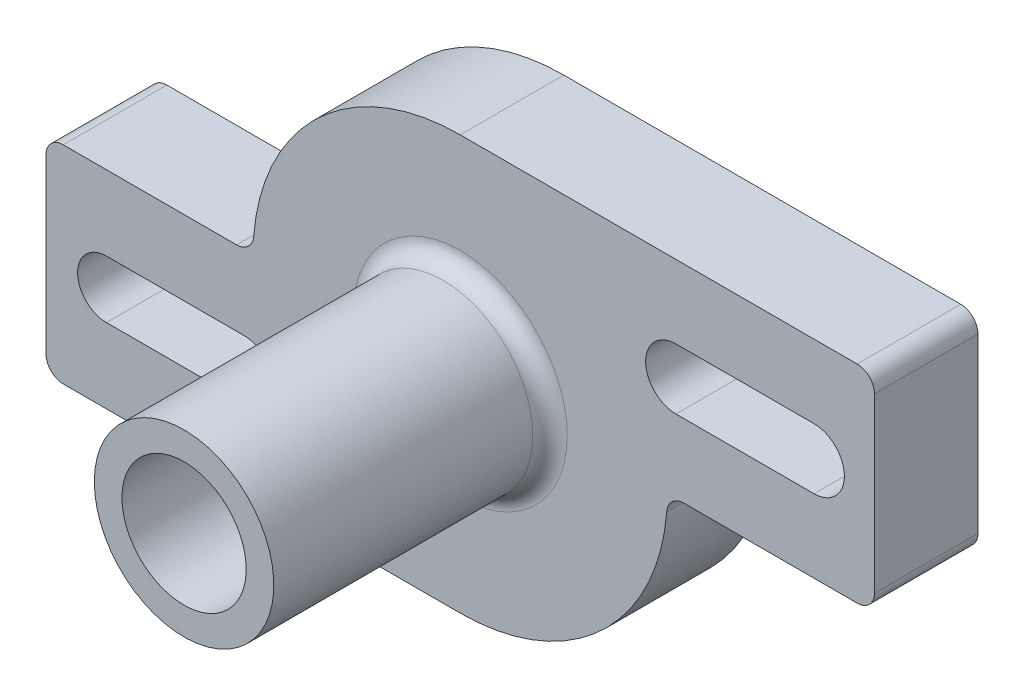
from build123d import *

# Parameters (mm, degrees)
BOSS_EXTRUDE1_DEPTH                                  = 3
SKETCH2_R                                            = 2.6
BOSS_EXTRUDE2_DEPTH                                  = 8
FILLET1_R                                            = 0.5
CBORE_FOR_M3_HEX_SOCKET_THIN_HEAD_CAP_SC_D           = 3.6
CBORE_FOR_M3_HEX_SOCKET_THIN_HEAD_CAP_SC_CBORE_D     = 6.5
CBORE_FOR_M3_HEX_SOCKET_THIN_HEAD_CAP_SC_CBORE_DEPTH = 2.4


with BuildPart() as part:
    # Sketch1 → Boss-Extrude1 (new body)
    with BuildSketch(Plane.XY):
        with BuildLine():
            Line((-47.789798407, 94.395653496), (-35.789798407, 94.395653496))
            Line((-35.789798407, 94.395653496), (-35.789798407, 88.395653496))
            Line((-35.789798407, 88.395653496), (-41.789798407, 88.395653496))
            ThreePointArc((-41.789798407, 88.395653496), (-43.54715772, 84.153012809), (-47.789798407, 82.395653496))
            Line((-47.789798407, 82.395653496), (-59.789798407, 82.395653496))
            Line((-59.789798407, 82.395653496), (-59.789798407, 88.395653496))
            Line((-59.789798407, 88.395653496), (-53.789798407, 88.395653496))
            ThreePointArc((-53.789798407, 88.395653496), (-52.032439094, 92.638294183), (-47.789798407, 94.395653496))
        make_face()
        with BuildLine():
            Line((-37.539798407, 90.516657199), (-41.539798407, 90.516657199))
            ThreePointArc((-41.539798407, 90.516657199), (-42.418794704, 91.395653496), (-41.539798407, 92.274649793))
            Line((-41.539798407, 92.274649793), (-37.539798407, 92.274649793))
            ThreePointArc((-37.539798407, 92.274649793), (-36.66080211, 91.395653496), (-37.539798407, 90.516657199))
        make_face(mode=Mode.SUBTRACT)
        with BuildLine():
            Line((-58.039798407, 86.229692735), (-54.039798407, 86.229692735))
            ThreePointArc((-54.039798407, 86.229692735), (-53.205759169, 85.395653496), (-54.039798407, 84.561614258))
            Line((-54.039798407, 84.561614258), (-58.039798407, 84.561614258))
            ThreePointArc((-58.039798407, 84.561614258), (-58.873837646, 85.395653496), (-58.039798407, 86.229692735))
        make_face(mode=Mode.SUBTRACT)
    extrude(amount=BOSS_EXTRUDE1_DEPTH)

    # Sketch2 → Boss-Extrude2 (add)
    with BuildSketch(Plane(origin=(0, 0, 3), x_dir=(-1, 0, 0), z_dir=(0, 0, -1))):
        with Locations((47.789798407, 88.395653496)):
            Circle(SKETCH2_R)
    extrude(amount=-BOSS_EXTRUDE2_DEPTH)

    # Fillet1
    fillet1_edges = [part.edges().sort_by_distance(p)[0] for p in [
        (-35.789798407, 94.395653496, 1.5),
        (-35.789798407, 88.395653496, 1.5),
        (-41.789798407, 88.395653496, 1.5),
        (-59.789798407, 82.395653496, 1.5),
        (-59.789798407, 88.395653496, 1.5),
        (-53.789798407, 88.395653496, 1.5),
        (-45.189798407, 88.395653496, 3),
    ]]
    fillet(fillet1_edges, radius=FILLET1_R)

    # CBORE for M3 Hex Socket Thin Head Cap Screw1 (through all)
    with Locations(Plane(origin=(0, 0, 0), x_dir=(-1, 0, 0), z_dir=(0, 0, -1))):
        with Locations((47.789798407, 88.395653496)):
            CounterBoreHole(CBORE_FOR_M3_HEX_SOCKET_THIN_HEAD_CAP_SC_D / 2, CBORE_FOR_M3_HEX_SOCKET_THIN_HEAD_CAP_SC_CBORE_D / 2, CBORE_FOR_M3_HEX_SOCKET_THIN_HEAD_CAP_SC_CBORE_DEPTH)


solid = part.part
